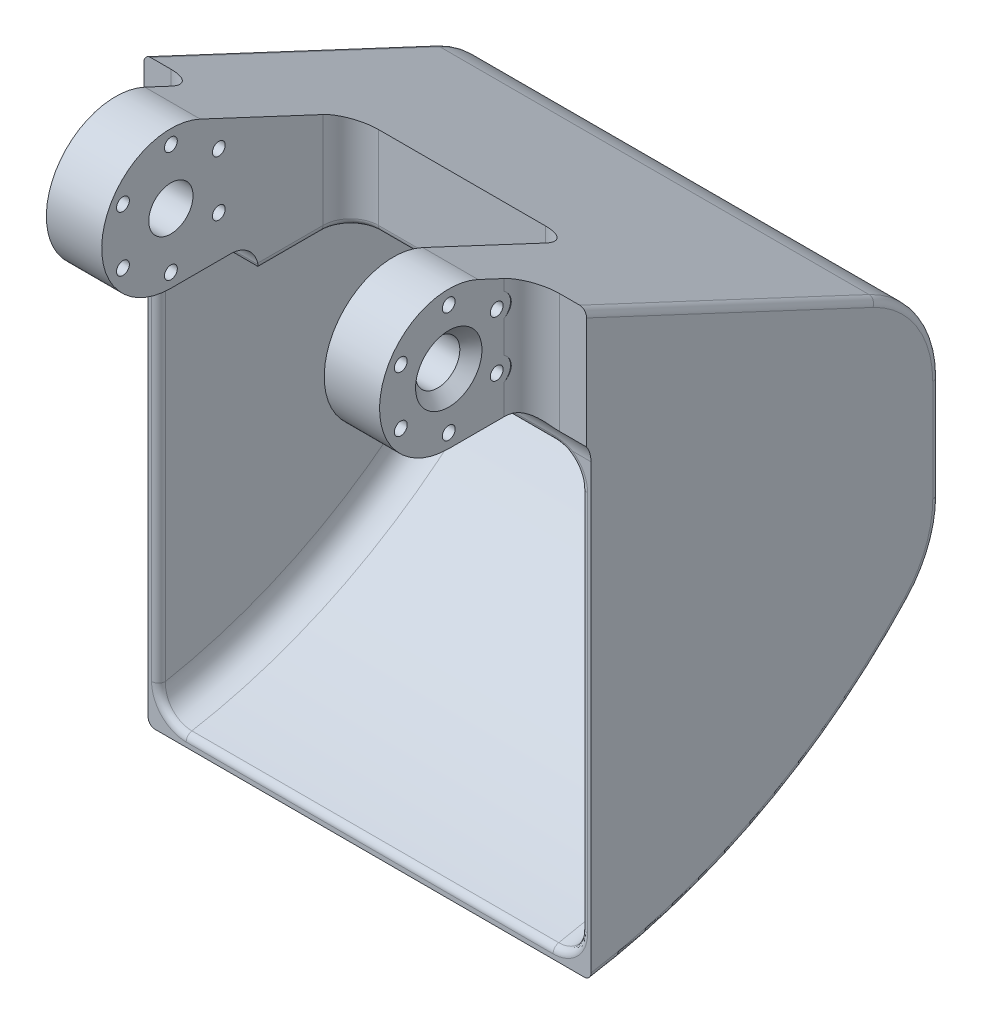
from build123d import *

# Parameters (mm, degrees)
BOSS_EXTRUDE1_DEPTH       = 101.6
FILLET1_R                 = 25.4
SKETCH2_W                 = 101.6
SKETCH2_H                 = 36.957
CUT_EXTRUDE1_DEPTH        = 179.74841613
SHELL1_T                  = -2.3622
FILLET2_R                 = 6.35
BOSS_EXTRUDE2_DEPTH       = 101.6
FILLET3_R                 = 6.35
CUT_EXTRUDE2_REACH        = 202.738
SKETCH6_W                 = 51.054
SKETCH6_H                 = 57.15
SKETCH6_W_2               = 12.573
SKETCH6_H_2               = 34.925
SKETCH7_R                 = 5.08
CUT_EXTRUDE3_DEPTH        = 184.481243651
FILLET4_R                 = 6.35
FILLET5_R                 = 1.5875
FILLET6_R                 = 1.5875
F_4_CLEARANCE_HOLE1_D     = 2.9464
F_4_CLEARANCE_HOLE1_DEPTH = 12.701
CIRPATTERN1_COUNT         = 6
CUT_EXTRUDE4_REACH        = 185.481
SKETCH13_R                = 3.175
MIRROR1_COPY_1_D          = 2.9464
MIRROR1_COPY_1_DEPTH      = 12.701
MIRROR1_COPY_2_D          = 2.9464
MIRROR1_COPY_2_DEPTH      = 12.701
MIRROR1_COPY_3_D          = 2.9464
MIRROR1_COPY_3_DEPTH      = 12.701
MIRROR1_COPY_4_D          = 2.9464
MIRROR1_COPY_4_DEPTH      = 12.701
MIRROR1_COPY_5_D          = 2.9464
MIRROR1_COPY_5_DEPTH      = 12.701
CHAMFER1_SIZE             = 2.54
CHAMFER2_SIZE             = 2.54


with BuildPart() as part:
    # Sketch1 → Boss-Extrude1 (new body)
    with BuildSketch(Plane(origin=(0, 0, 0), x_dir=(0, 0, -1), z_dir=(1, 0, 0))):
        with BuildLine():
            Line((100.066, -78.20355263), (100.066, -20.066))
            Line((100.066, -20.066), (23.241, -20.066))
            Line((23.241, -20.066), (23.241, 16.891))
            Line((23.241, 16.891), (20.066, 16.891))
            Line((20.066, 16.891), (20.066, -125.40476723))
            ThreePointArc((20.066, -125.40476723), (64.536137326, -109.38046891), (100.066, -78.20355263))
        make_face()
    extrude(amount=BOSS_EXTRUDE1_DEPTH)

    # Fillet1
    fillet1_edges = [part.edges().sort_by_distance(p)[0] for p in [
        (50.8, -20.066, -100.066),
        (50.8, -78.20355263, -100.066),
    ]]
    fillet(fillet1_edges, radius=FILLET1_R)

    # Sketch2 → Cut-Extrude1 (cut, through all)
    with BuildSketch(Plane(origin=(0, 0, -23.241), x_dir=(-1, 0, 0), z_dir=(0, 0, -1))):
        with Locations((-50.8, -1.5875)):
            Rectangle(SKETCH2_W, SKETCH2_H)
    extrude(amount=-CUT_EXTRUDE1_DEPTH, mode=Mode.SUBTRACT)

    # Shell1
    shell1_openings = [part.faces().sort_by_distance(p)[0] for p in [
        (50.8, -72.735383615, -20.066),
    ]]
    offset(amount=SHELL1_T, openings=shell1_openings, kind=Kind.INTERSECTION)

    # Fillet2
    fillet2_edges = [part.edges().sort_by_distance(p)[0] for p in [
        (2.3622, -109.759563078, -59.054377499),
        (2.3622, -57.184228004, -97.7038),
        (2.3622, -22.4282, -47.366),
        (99.2378, -22.4282, -47.366),
        (99.2378, -109.759563078, -59.054377499),
        (99.2378, -77.28989897, -96.122724573),
        (99.2378, -57.184228004, -97.7038),
        (99.2378, -29.175815396, -90.956184604),
        (2.3622, -29.175815396, -90.956184604),
        (2.3622, -77.28989897, -96.122724573),
    ]]
    fillet(fillet2_edges, radius=FILLET2_R)

    # Sketch4 → Boss-Extrude2 (add)
    with BuildSketch(Plane(origin=(101.6, 0, 0), x_dir=(0, 0, -1), z_dir=(1, 0, 0))):
        with BuildLine():
            Line((0, -15.875), (20.066, -15.875))
            Line((20.066, -15.875), (20.066, -20.066))
            Line((20.066, -20.066), (74.666, -20.066))
            ThreePointArc((74.666, -20.066), (80.181540551, -20.672073074), (85.43386688, -22.4613691))
            Line((85.43386688, -22.4613691), (6.7299168, 14.377894312))
            ThreePointArc((6.7299168, 14.377894312), (-15.496204329, 3.447212844), (0, -15.875))
        make_face()
    extrude(amount=-BOSS_EXTRUDE2_DEPTH)

    # Fillet3
    fillet3_edges = [part.edges().sort_by_distance(p)[0] for p in [
        (50.8, -15.875, -20.066),
    ]]
    fillet(fillet3_edges, radius=FILLET3_R)

    # Sketch6 → Cut-Extrude2 (cut, up to next)
    with BuildSketch(Plane(origin=(0, 15.875, 0), x_dir=(-1, 0, 0), z_dir=(0, 1, 0)), mode=Mode.PRIVATE) as cut_extrude2_sk1:
        with Locations((-50.8, -12.7)):
            Rectangle(SKETCH6_W, SKETCH6_H)
    cut_extrude2_tool1 = extrude(cut_extrude2_sk1.sketch, amount=-CUT_EXTRUDE2_REACH, mode=Mode.PRIVATE) & part.part
    # Sketch6 → Cut-Extrude2 (cut, up to next)
    with BuildSketch(Plane(origin=(0, 15.875, 0), x_dir=(-1, 0, 0), z_dir=(0, 1, 0)), mode=Mode.PRIVATE) as cut_extrude2_sk2:
        with Locations((-95.3135, -1.5875)):
            Rectangle(SKETCH6_W_2, SKETCH6_H_2)
    cut_extrude2_tool2 = extrude(cut_extrude2_sk2.sketch, amount=-CUT_EXTRUDE2_REACH, mode=Mode.PRIVATE) & part.part
    # Sketch6 → Cut-Extrude2 (cut, up to next)
    with BuildSketch(Plane(origin=(0, 15.875, 0), x_dir=(-1, 0, 0), z_dir=(0, 1, 0)), mode=Mode.PRIVATE) as cut_extrude2_sk3:
        with Locations((-6.2865, -1.5875)):
            Rectangle(SKETCH6_W_2, SKETCH6_H_2)
    cut_extrude2_tool3 = extrude(cut_extrude2_sk3.sketch, amount=-CUT_EXTRUDE2_REACH, mode=Mode.PRIVATE) & part.part
    add(cut_extrude2_tool1.solids().sort_by_distance((50.8, 15.875, -12.7))[0], mode=Mode.SUBTRACT)
    add(cut_extrude2_tool2.solids().sort_by_distance((95.3135, 15.875, -1.5875))[0], mode=Mode.SUBTRACT)
    add(cut_extrude2_tool3.solids().sort_by_distance((6.2865, 15.875, -1.5875))[0], mode=Mode.SUBTRACT)

    # Sketch7 → Cut-Extrude3 (cut, through all)
    with BuildSketch(Plane(origin=(89.027, 0, 0), x_dir=(0, 0, -1), z_dir=(1, 0, 0))):
        Circle(SKETCH7_R)
    extrude(amount=-CUT_EXTRUDE3_DEPTH, mode=Mode.SUBTRACT)

    # Fillet4
    fillet4_edges = [part.edges().sort_by_distance(p)[0] for p in [
        (12.573, -5.084195611, -19.05),
        (25.273, -12.109978436, -41.275),
        (76.327, -12.109978436, -41.275),
        (89.027, -5.084195611, -19.05),
    ]]
    fillet(fillet4_edges, radius=FILLET4_R)

    # Fillet5
    fillet5_edges = [part.edges().sort_by_distance(p)[0] for p in [
        (101.6, -111.930917593, -60.003913928),
        (101.6, -6.925091976, -52.24193344),
        (0, -6.925091976, -52.24193344),
        (0, -57.184228004, -100.066),
        (101.6, -57.184228004, -100.066),
        (0, -78.149912416, -98.322807688),
        (101.6, -31.834122264, -96.098029987),
        (101.6, -78.149912416, -98.322807688),
        (0, -111.930917593, -60.003913928),
        (0, -31.834122264, -96.098029987),
    ]]
    fillet(fillet5_edges, radius=FILLET5_R)

    # Fillet6
    fillet6_edges = [part.edges().sort_by_distance(p)[0] for p in [
        (76.327, -22.4282, -27.4955),
        (74.467128061, -22.4282, -39.415128061),
        (50.8, -22.4282, -41.275),
        (25.273, -22.4282, -27.4955),
        (84.6074, -22.4282, -20.066),
        (97.377928061, -24.288071939, -20.066),
        (99.2378, -72.675803614, -20.066),
        (97.393945949, -121.110809367, -20.066),
        (16.9926, -22.4282, -20.066),
        (4.222071939, -24.288071939, -20.066),
        (2.3622, -72.675803614, -20.066),
        (4.206054052, -121.110809366, -20.066),
        (27.132871939, -22.4282, -39.415128061),
        (50.8, -123.011937766, -20.066),
    ]]
    fillet(fillet6_edges, radius=FILLET6_R)

    # #4 Clearance Hole1
    with Locations(Plane(origin=(89.027, 0, 0), x_dir=(0, 0, -1), z_dir=(1, 0, 0))):
        with Locations((0, 12.7)):
            f_4_clearance_hole1 = Hole(F_4_CLEARANCE_HOLE1_D / 2, depth=F_4_CLEARANCE_HOLE1_DEPTH)

    # CirPattern1: #4 Clearance Hole1 ×6 about axis
    cirpattern1_axis = Axis((0, 0, 0), (1, 0, 0))
    for i in range(1, CIRPATTERN1_COUNT):
        add(f_4_clearance_hole1.rotate(cirpattern1_axis, i * 360 / CIRPATTERN1_COUNT), mode=Mode.SUBTRACT)

    # Sketch13 → Cut-Extrude4 (cut, up to next)
    with BuildSketch(Plane(origin=(89.027, 0, 0), x_dir=(0, 0, -1), z_dir=(1, 0, 0)), mode=Mode.PRIVATE) as cut_extrude4_sk1:
        with Locations((10.998522628, 6.35)):
            Circle(SKETCH13_R)
    cut_extrude4_tool1 = extrude(cut_extrude4_sk1.sketch, amount=CUT_EXTRUDE4_REACH, mode=Mode.PRIVATE) & part.part
    # Sketch13 → Cut-Extrude4 (cut, up to next)
    with BuildSketch(Plane(origin=(89.027, 0, 0), x_dir=(0, 0, -1), z_dir=(1, 0, 0)), mode=Mode.PRIVATE) as cut_extrude4_sk2:
        with Locations((10.998522628, -6.35)):
            Circle(SKETCH13_R)
    cut_extrude4_tool2 = extrude(cut_extrude4_sk2.sketch, amount=CUT_EXTRUDE4_REACH, mode=Mode.PRIVATE) & part.part
    cut_extrude4_1 = cut_extrude4_tool1.solids().sort_by_distance((89.027, 6.35, -10.998523))[0]
    add(cut_extrude4_1, mode=Mode.SUBTRACT)
    cut_extrude4_2 = cut_extrude4_tool2.solids().sort_by_distance((89.027, -6.35, -10.998523))[0]
    add(cut_extrude4_2, mode=Mode.SUBTRACT)
    cut_extrude4 = cut_extrude4_1 + cut_extrude4_2  # Cut-Extrude4 as one shape, for the pattern or mirror that repeats it

    # Mirror1: #4 Clearance Hole1, Cut-Extrude4 across plane
    add(f_4_clearance_hole1.mirror(Plane.ZY.offset(-50.8)), mode=Mode.SUBTRACT)
    add(cut_extrude4.mirror(Plane.ZY.offset(-50.8)), mode=Mode.SUBTRACT)

    # Mirror1 copy 1
    with Locations(Plane(origin=(12.573, 0, 0), x_dir=(0, 0.8660254037844386, -0.5000000000000001), z_dir=(-1, 0, 0))):
        with Locations((0, -12.7)):
            Hole(MIRROR1_COPY_1_D / 2, depth=MIRROR1_COPY_1_DEPTH)

    # Mirror1 copy 2
    with Locations(Plane(origin=(12.573, 0, 0), x_dir=(0, 0.8660254037844387, 0.4999999999999998), z_dir=(-1, 0, 0))):
        with Locations((0, -12.7)):
            Hole(MIRROR1_COPY_2_D / 2, depth=MIRROR1_COPY_2_DEPTH)

    # Mirror1 copy 3
    with Locations(Plane.ZY.offset(-12.573)):
        with Locations((0, -12.7)):
            Hole(MIRROR1_COPY_3_D / 2, depth=MIRROR1_COPY_3_DEPTH)

    # Mirror1 copy 4
    with Locations(Plane(origin=(12.573, 0, 0), x_dir=(0, -0.8660254037844384, 0.5000000000000004), z_dir=(-1, 0, 0))):
        with Locations((0, -12.7)):
            Hole(MIRROR1_COPY_4_D / 2, depth=MIRROR1_COPY_4_DEPTH)

    # Mirror1 copy 5
    with Locations(Plane(origin=(12.573, 0, 0), x_dir=(0, -0.8660254037844386, -0.5000000000000001), z_dir=(-1, 0, 0))):
        with Locations((0, -12.7)):
            Hole(MIRROR1_COPY_5_D / 2, depth=MIRROR1_COPY_5_DEPTH)

    # Chamfer1
    chamfer1_edges = [part.edges().sort_by_distance(p)[0] for p in [
        (89.027, 0, 5.08),
    ]]
    chamfer(chamfer1_edges, length=CHAMFER1_SIZE)

    # Chamfer2
    chamfer2_edges = [part.edges().sort_by_distance(p)[0] for p in [
        (12.573, 0, 5.08),
    ]]
    chamfer(chamfer2_edges, length=CHAMFER2_SIZE)


solid = part.part
